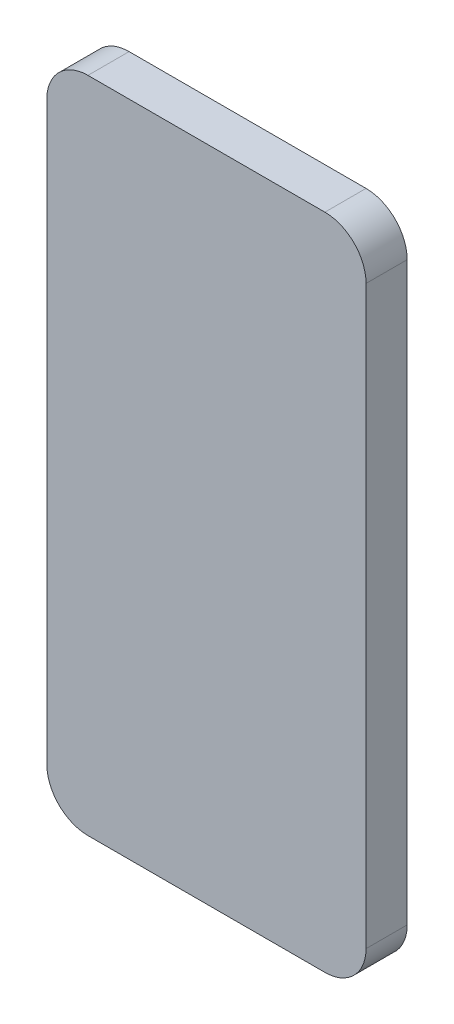
from build123d import *

# Parameters (mm, degrees)
BOSS_EXTRUDE1_DEPTH = 10


with BuildPart() as part:
    # Sketch1 → Boss-Extrude1 (new body)
    with BuildSketch(Plane.XY):
        with BuildLine():
            Line((-28.79, 42.979318129), (28.79, 42.979318129))
            ThreePointArc((28.79, 42.979318129), (35.861067812, 40.050385941), (38.79, 32.979318129))
            Line((38.79, 32.979318129), (38.79, -107.020681871))
            ThreePointArc((38.79, -107.020681871), (35.861067812, -114.091749683), (28.79, -117.020681871))
            Line((28.79, -117.020681871), (-28.79, -117.020681871))
            ThreePointArc((-28.79, -117.020681871), (-35.861067812, -114.091749683), (-38.79, -107.020681871))
            Line((-38.79, -107.020681871), (-38.79, 32.979318129))
            ThreePointArc((-38.79, 32.979318129), (-35.861067812, 40.050385941), (-28.79, 42.979318129))
        make_face()
    extrude(amount=BOSS_EXTRUDE1_DEPTH)


solid = part.part
